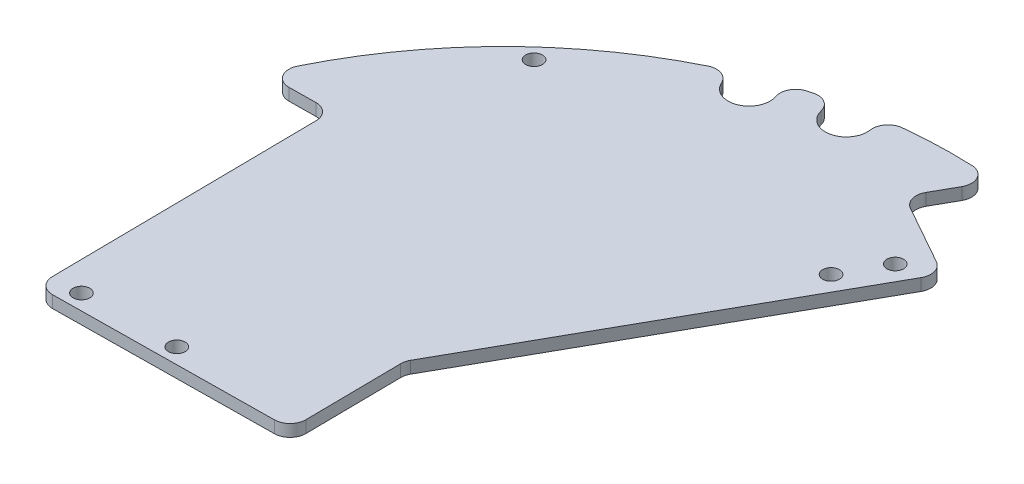
from build123d import *

# Parameters (mm, degrees)
SKETCH1_R           = 1.6
BOSS_EXTRUDE1_DEPTH = 2.3
FILLET1_R           = 3
SKETCH3_R           = 4
CUT_EXTRUDE1_DEPTH  = 44.3
FILLET2_R           = 3


with BuildPart() as part:
    # Sketch1 → Boss-Extrude1 (new body)
    with BuildSketch(Plane(origin=(0, 0, 0), x_dir=(1, 0, 0), z_dir=(0, 1, 0))):
        with BuildLine():
            Line((18.815976516, 65.132242613), (2.251488694, 74.439107992))
            Line((2.251488694, 74.439107992), (8.509906392, 85.577926437))
            ThreePointArc((8.509906392, 85.577926437), (-43.86830382, 73.970074489), (-79.174773721, 33.576110647))
            Line((-79.174773721, 33.576110647), (-66.399065131, 33.725571155))
            Line((-66.399065131, 33.725571155), (-65.732278943, -23.270528678))
            Line((-65.732278943, -23.270528678), (-17.85230327, -22.710390238))
            Line((-17.85230327, -22.710390238), (-18.111073304, -0.591031778))
            Line((-18.111073304, -0.591031778), (18.815976516, 65.132242613))
        make_face()
        with Locations(Location((12.634623312, 62.296599376, 0), (0, 0, 270))):
            Circle(SKETCH1_R, mode=Mode.SUBTRACT)
        with Locations(Location((8.226108132, 54.450263039, 0), (0, 0, 270))):
            Circle(SKETCH1_R, mode=Mode.SUBTRACT)
        with Locations(Location((-42.268980916, -19.995830873, 0), (0, 0, 270))):
            Circle(SKETCH1_R, mode=Mode.SUBTRACT)
        with Locations(Location((-60.267749285, -20.206394932, 0), (0, 0, 270))):
            Circle(SKETCH1_R, mode=Mode.SUBTRACT)
        with Locations(Location((-55.633474662, 61.59477654, 0), (0, 0, 270))):
            Circle(SKETCH1_R, mode=Mode.SUBTRACT)
    extrude(amount=BOSS_EXTRUDE1_DEPTH)

    # Fillet1
    fillet1_edges = [part.edges().sort_by_distance(p)[0] for p in [
        (8.509906392, 1.15, -85.577926437),
        (2.251488694, 1.15, -74.439107992),
        (18.815976516, 1.15, -65.132242613),
        (-18.111073304, 1.15, 0.591031778),
        (-17.85230327, 1.15, 22.710390238),
        (-65.732278943, 1.15, 23.270528678),
        (-66.399065131, 1.15, -33.725571155),
        (-79.174773721, 1.15, -33.576110647),
    ]]
    fillet(fillet1_edges, radius=FILLET1_R)

    # Sketch3 → Cut-Extrude1 (cut)
    with BuildSketch(Plane(origin=(0, 2.3, 0), x_dir=(1, 0, 0), z_dir=(0, 1, 0))):
        with Locations((-30.257228913, 77.288421504)):
            Circle(SKETCH3_R)
        with Locations((-15.872582201, 81.468160248)):
            Circle(SKETCH3_R)
    extrude(amount=-CUT_EXTRUDE1_DEPTH, mode=Mode.SUBTRACT)

    # Fillet2
    fillet2_edges = [part.edges().sort_by_distance(p)[0] for p in [
        (-28.827983469, 1.15, -81.024362812),
        (-33.842999164, 1.15, -79.06106126),
        (-13.795112573, 1.15, -84.886364447),
        (-19.081339078, 1.15, -83.856439818),
    ]]
    fillet(fillet2_edges, radius=FILLET2_R)


solid = part.part
